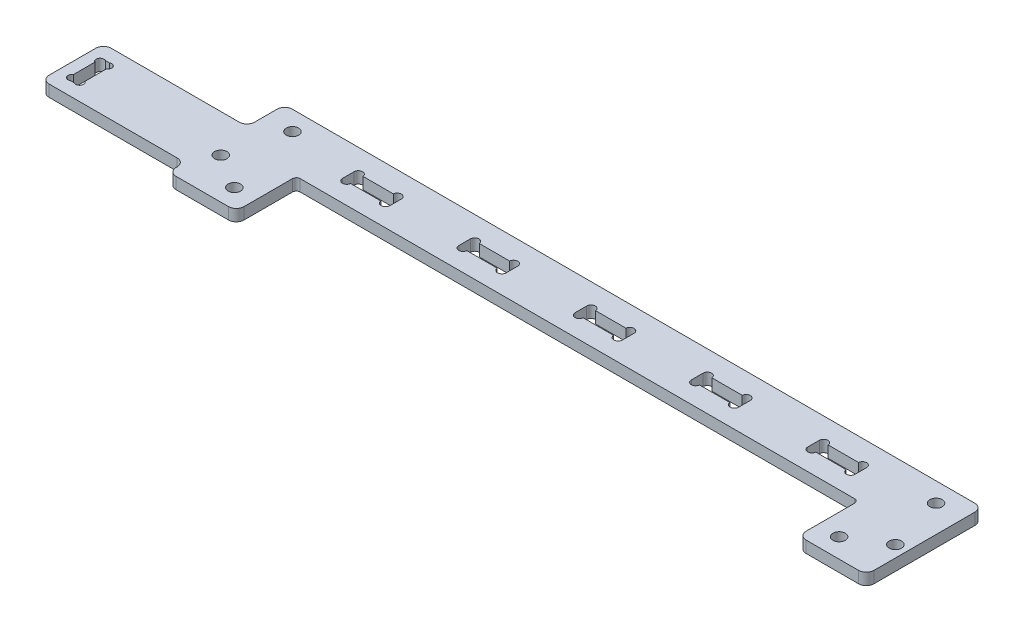
from build123d import *

# Parameters (mm, degrees)
SKETCH_1_R          = 1.6
EXTRUDE_1_DEPTH     = 3
SKETCH_3_R          = 1.6
CUT_EXTRUDE_1_DEPTH = 92.290744328
FILLET_1_R          = 1
SKETCH_4_W          = 12
SKETCH_4_H          = 3
CUT_EXTRUDE_2_DEPTH = 92.290744328
SKETCH_5_R          = 1
CUT_EXTRUDE_3_DEPTH = 92.290744328
CUT_EXTRUDE_4_DEPTH = 92.290744328
SKETCH_7_W          = 37
SKETCH_7_H          = 16
SKETCH_7_W_2        = 3
SKETCH_7_H_2        = 9
EXTRUDE_2_DEPTH     = 3
SKETCH_8_R          = 1
CUT_EXTRUDE_5_DEPTH = 128.917942447
FILLET_3_R          = 2


with BuildPart() as part:
    # 草图1 → 凸台-拉伸1 (new body)
    with BuildSketch(Plane(origin=(0, 0, 0), x_dir=(1, 0, 0), z_dir=(0, 1, 0))):
        Polygon((-90, -15), (-72.5, -15), (-72.5, 0.5), (72.5, 0.5), (72.5, -15), (90, -15), (90, 15), (-90, 15), align=None)
        with Locations(Location((78, -10, 0), (0, 0, 270))):
            Circle(SKETCH_1_R, mode=Mode.SUBTRACT)
        with Locations(Location((-78, -10, 0), (0, 0, 90))):
            Circle(SKETCH_1_R, mode=Mode.SUBTRACT)
        with Locations(Location((-83, 10, 0), (0, 0, 270))):
            Circle(SKETCH_1_R, mode=Mode.SUBTRACT)
        with Locations(Location((83, 10, 0), (0, 0, 90))):
            Circle(SKETCH_1_R, mode=Mode.SUBTRACT)
    extrude(amount=EXTRUDE_1_DEPTH)

    # 草图3 → 切除-拉伸1 (cut, through all)
    with BuildSketch(Plane(origin=(0, 3, 0), x_dir=(1, 0, 0), z_dir=(0, 1, 0))):
        with Locations(Location((87, -4.5, 0), (0, 0, 90))):
            Circle(SKETCH_3_R)
        with Locations(Location((-87, -4.5, 0), (0, 0, 270))):
            Circle(SKETCH_3_R)
    extrude(amount=-CUT_EXTRUDE_1_DEPTH, mode=Mode.SUBTRACT)

    # 圆角1
    fillet_1_edges = [part.edges().sort_by_distance(p)[0] for p in [
        (72.5, 1.5, -0.5),
        (-72.5, 1.5, -0.5),
    ]]
    fillet(fillet_1_edges, radius=FILLET_1_R)

    # 草图4 → 切除-拉伸2 (cut, through all)
    with BuildSketch(Plane.XZ):
        with Locations((60, -7.5)):
            Rectangle(SKETCH_4_W, SKETCH_4_H)
        with Locations((30, -7.5)):
            Rectangle(SKETCH_4_W, SKETCH_4_H)
        with Locations((0, -7.5)):
            Rectangle(SKETCH_4_W, SKETCH_4_H)
        with Locations((-30, -7.5)):
            Rectangle(SKETCH_4_W, SKETCH_4_H)
        with Locations((-60, -7.5)):
            Rectangle(SKETCH_4_W, SKETCH_4_H)
    extrude(amount=-CUT_EXTRUDE_2_DEPTH, mode=Mode.SUBTRACT)

    # 草图5 → 切除-拉伸3 (cut, through all)
    with BuildSketch(Plane.XZ):
        with Locations((65, -9)):
            Circle(SKETCH_5_R)
        with Locations((55, -9)):
            Circle(SKETCH_5_R)
        with Locations((55, -6)):
            Circle(SKETCH_5_R)
        with Locations((65, -6)):
            Circle(SKETCH_5_R)
        with Locations((35, -9)):
            Circle(SKETCH_5_R)
        with Locations((25, -9)):
            Circle(SKETCH_5_R)
        with Locations((25, -6)):
            Circle(SKETCH_5_R)
        with Locations((35, -6)):
            Circle(SKETCH_5_R)
        with Locations((5, -9)):
            Circle(SKETCH_5_R)
        with Locations((-5, -9)):
            Circle(SKETCH_5_R)
        with Locations((-5, -6)):
            Circle(SKETCH_5_R)
        with Locations((5, -6)):
            Circle(SKETCH_5_R)
        with Locations((-25, -9)):
            Circle(SKETCH_5_R)
        with Locations((-35, -9)):
            Circle(SKETCH_5_R)
        with Locations((-35, -6)):
            Circle(SKETCH_5_R)
        with Locations((-25, -6)):
            Circle(SKETCH_5_R)
        with Locations((-55, -9)):
            Circle(SKETCH_5_R)
        with Locations((-65, -9)):
            Circle(SKETCH_5_R)
        with Locations((-65, -6)):
            Circle(SKETCH_5_R)
        with Locations((-55, -6)):
            Circle(SKETCH_5_R)
    extrude(amount=-CUT_EXTRUDE_3_DEPTH, mode=Mode.SUBTRACT)

    # 草图6 → 切除-拉伸4 (cut, through all)
    with BuildSketch(Plane.XZ):
        with BuildLine():
            Line((36.1, -9), (36.1, -6))
            ThreePointArc((36.1, -6), (35.050051841, -4.901139311), (33.904554885, -5.9))
            Line((33.904554885, -5.9), (26.095445115, -5.9))
            ThreePointArc((26.095445115, -5.9), (24.949948159, -4.901139311), (23.9, -6))
            Line((23.9, -6), (23.9, -9))
            ThreePointArc((23.9, -9), (24.949948159, -10.098860689), (26.095445115, -9.1))
            Line((26.095445115, -9.1), (33.904554885, -9.1))
            ThreePointArc((33.904554885, -9.1), (35.050051841, -10.098860689), (36.1, -9))
        make_face()
        with BuildLine():
            Line((66.1, -9), (66.1, -6))
            ThreePointArc((66.1, -6), (65.050051841, -4.901139311), (63.904554885, -5.9))
            Line((63.904554885, -5.9), (56.095445115, -5.9))
            ThreePointArc((56.095445115, -5.9), (54.949948159, -4.901139311), (53.9, -6))
            Line((53.9, -6), (53.9, -9))
            ThreePointArc((53.9, -9), (54.949948159, -10.098860689), (56.095445115, -9.1))
            Line((56.095445115, -9.1), (63.904554885, -9.1))
            ThreePointArc((63.904554885, -9.1), (65.050051841, -10.098860689), (66.1, -9))
        make_face()
        with BuildLine():
            Line((6.1, -9), (6.1, -6))
            ThreePointArc((6.1, -6), (5.050051841, -4.901139311), (3.904554885, -5.9))
            Line((3.904554885, -5.9), (-3.904554885, -5.9))
            ThreePointArc((-3.904554885, -5.9), (-5.050051841, -4.901139311), (-6.1, -6))
            Line((-6.1, -6), (-6.1, -9))
            ThreePointArc((-6.1, -9), (-5.050051841, -10.098860689), (-3.904554885, -9.1))
            Line((-3.904554885, -9.1), (3.904554885, -9.1))
            ThreePointArc((3.904554885, -9.1), (5.050051841, -10.098860689), (6.1, -9))
        make_face()
        with BuildLine():
            Line((-23.9, -9), (-23.9, -6))
            ThreePointArc((-23.9, -6), (-24.949948159, -4.901139311), (-26.095445115, -5.9))
            Line((-26.095445115, -5.9), (-33.904554885, -5.9))
            ThreePointArc((-33.904554885, -5.9), (-35.050051841, -4.901139311), (-36.1, -6))
            Line((-36.1, -6), (-36.1, -9))
            ThreePointArc((-36.1, -9), (-35.050051841, -10.098860689), (-33.904554885, -9.1))
            Line((-33.904554885, -9.1), (-26.095445115, -9.1))
            ThreePointArc((-26.095445115, -9.1), (-24.949948159, -10.098860689), (-23.9, -9))
        make_face()
        with BuildLine():
            Line((-53.9, -9), (-53.9, -6))
            ThreePointArc((-53.9, -6), (-54.949948159, -4.901139311), (-56.095445115, -5.9))
            Line((-56.095445115, -5.9), (-63.904554885, -5.9))
            ThreePointArc((-63.904554885, -5.9), (-65.050051841, -4.901139311), (-66.1, -6))
            Line((-66.1, -6), (-66.1, -9))
            ThreePointArc((-66.1, -9), (-65.050051841, -10.098860689), (-63.904554885, -9.1))
            Line((-63.904554885, -9.1), (-56.095445115, -9.1))
            ThreePointArc((-56.095445115, -9.1), (-54.949948159, -10.098860689), (-53.9, -9))
        make_face()
    extrude(amount=-CUT_EXTRUDE_4_DEPTH, mode=Mode.SUBTRACT)

    # 草图7 → 凸台-拉伸2 (add)
    with BuildSketch(Plane.XZ):
        with Locations((-108.5, 2.75)):
            Rectangle(SKETCH_7_W, SKETCH_7_H)
        with Locations((-122.5, 2.75)):
            Rectangle(SKETCH_7_W_2, SKETCH_7_H_2, mode=Mode.SUBTRACT)
    extrude(amount=-EXTRUDE_2_DEPTH)

    # 草图8 → 切除-拉伸5 (cut, through all)
    with BuildSketch(Plane(origin=(0, 3, 0), x_dir=(1, 0, 0), z_dir=(0, 1, 0))):
        with Locations((-123.5025, 0.882536024)):
            Circle(SKETCH_8_R)
        with Locations((-121.4975, 0.882536024)):
            Circle(SKETCH_8_R)
        with Locations((-121.4975, -6.382536024)):
            Circle(SKETCH_8_R)
        with Locations((-123.5025, -6.382536024)):
            Circle(SKETCH_8_R)
    extrude(amount=-CUT_EXTRUDE_5_DEPTH, mode=Mode.SUBTRACT)

    # 圆角3
    fillet_3_edges = [part.edges().sort_by_distance(p)[0] for p in [
        (90, 1.5, 15),
        (72.5, 1.5, 15),
        (-72.5, 1.5, 15),
        (-90, 1.5, 15),
        (-90, 1.5, -15),
        (90, 1.5, -15),
        (-127, 1.5, 10.75),
        (-127, 1.5, -5.25),
        (-90, 1.5, -5.25),
        (-90, 1.5, 10.75),
    ]]
    fillet(fillet_3_edges, radius=FILLET_3_R)


solid = part.part
